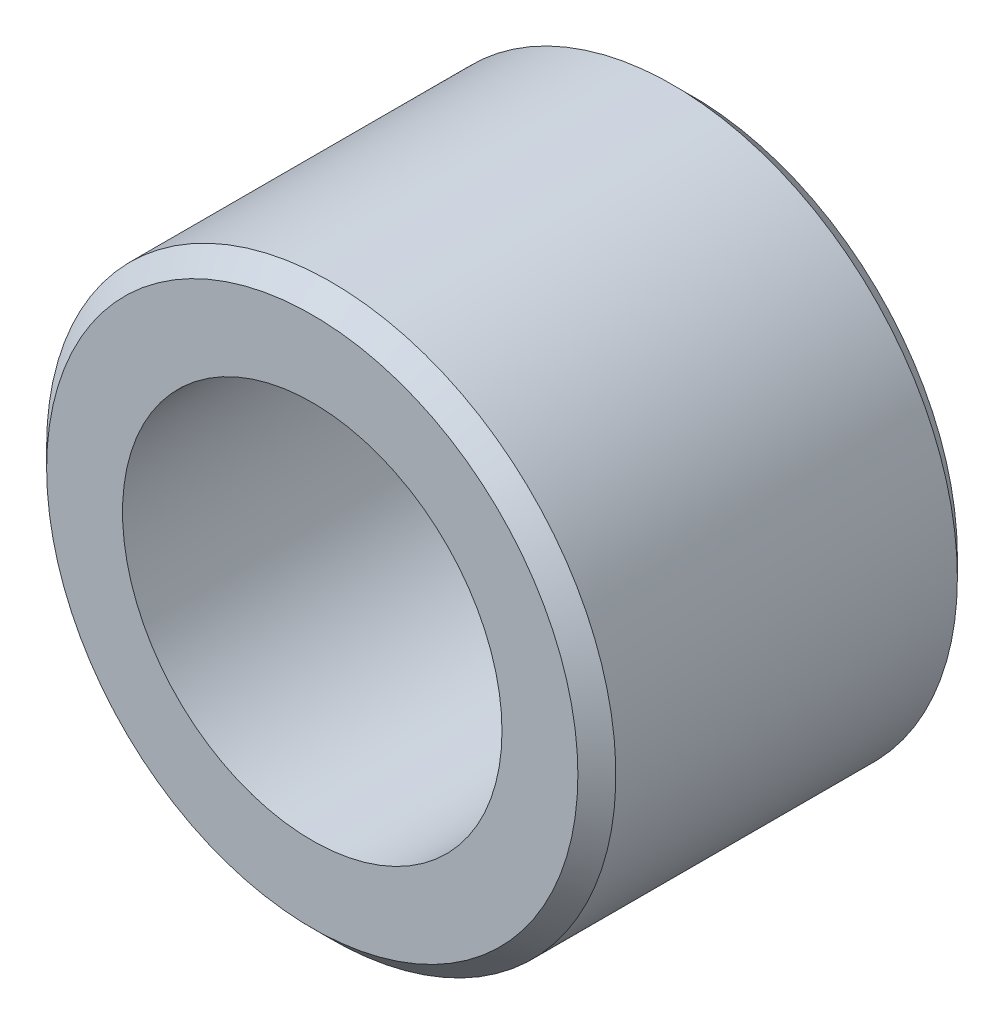
from build123d import *

# Parameters (mm, degrees)
SKETCH1_R           = 1.5
SKETCH1_R_2         = 1
BOSS_EXTRUDE1_DEPTH = 2
CHAMFER1_SIZE       = 0.1


with BuildPart() as part:
    # Sketch1 → Boss-Extrude1 (new body)
    with BuildSketch(Plane.XY):
        Circle(SKETCH1_R)
        Circle(SKETCH1_R_2, mode=Mode.SUBTRACT)
    extrude(amount=BOSS_EXTRUDE1_DEPTH)

    # Chamfer1
    chamfer1_edges = [part.edges().sort_by_distance(p)[0] for p in [
        (-1.5, 0, 0),
        (-1.5, 0, 2),
    ]]
    chamfer(chamfer1_edges, length=CHAMFER1_SIZE)


solid = part.part
